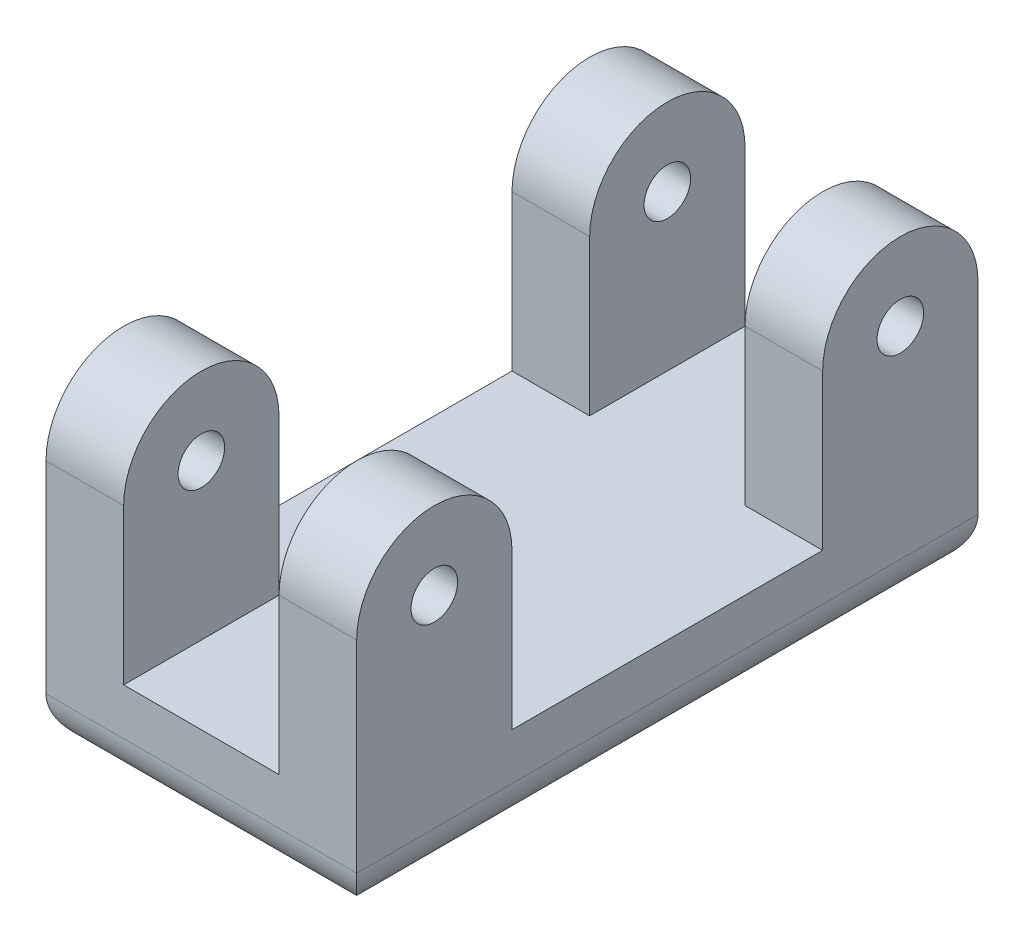
from build123d import *

# Parameters (mm, degrees)
BOSS_EXTRUDE1_DEPTH      = 20
BOSS_EXTRUDE1_DEPTH_BACK = 20
SKETCH1_W                = 20
SKETCH1_H                = 6
SKETCH2_R                = 1.5
BOSS_EXTRUDE2_DEPTH      = 20
SKETCH3_W                = 10
SKETCH3_H                = 15
CUT_EXTRUDE1_DEPTH       = 40
FILLET2_R                = 3


with BuildPart() as part:
    # Sketch1 → Boss-Extrude1 (new, two sides: drawn at the far end of the back side and taken through both)
    with BuildSketch(Plane.XY.offset(-BOSS_EXTRUDE1_DEPTH_BACK)):
        Rectangle(SKETCH1_W, SKETCH1_H)
    extrude(amount=BOSS_EXTRUDE1_DEPTH + BOSS_EXTRUDE1_DEPTH_BACK)

    # Sketch2 → Boss-Extrude2 (add)
    # profile 1 of 2: a face of its own
    with BuildSketch(Plane(origin=(10, 0, 0), x_dir=(0, 0, -1), z_dir=(1, 0, 0))):
        with BuildLine():
            Line((-20, 13), (-20, 3))
            Line((-20, 3), (-10, 3))
            Line((-10, 3), (-10, 13))
            ThreePointArc((-10, 13), (-15, 18), (-20, 13))
        make_face()
        with Locations((-15, 13)):
            Circle(SKETCH2_R, mode=Mode.SUBTRACT)
    # profile 2 of 2: a face of its own
    with BuildSketch(Plane(origin=(10, 0, 0), x_dir=(0, 0, -1), z_dir=(1, 0, 0))):
        with BuildLine():
            Line((10, 13), (10, 3))
            Line((10, 3), (20, 3))
            Line((20, 3), (20, 13))
            ThreePointArc((20, 13), (15, 18), (10, 13))
        make_face()
        with Locations((15, 13)):
            Circle(SKETCH2_R, mode=Mode.SUBTRACT)
    extrude(amount=-BOSS_EXTRUDE2_DEPTH)

    # Sketch3 → Cut-Extrude1 (cut)
    with BuildSketch(Plane.XY.offset(20)):
        with Locations((0, 10.5)):
            Rectangle(SKETCH3_W, SKETCH3_H)
    extrude(amount=-CUT_EXTRUDE1_DEPTH, mode=Mode.SUBTRACT)

    # Fillet2
    fillet2_edges = [part.edges().sort_by_distance(p)[0] for p in [
        (0, -3, -20),
        (-10, -3, 0),
        (0, -3, 20),
        (10, -3, 0),
    ]]
    fillet(fillet2_edges, radius=FILLET2_R)


solid = part.part
